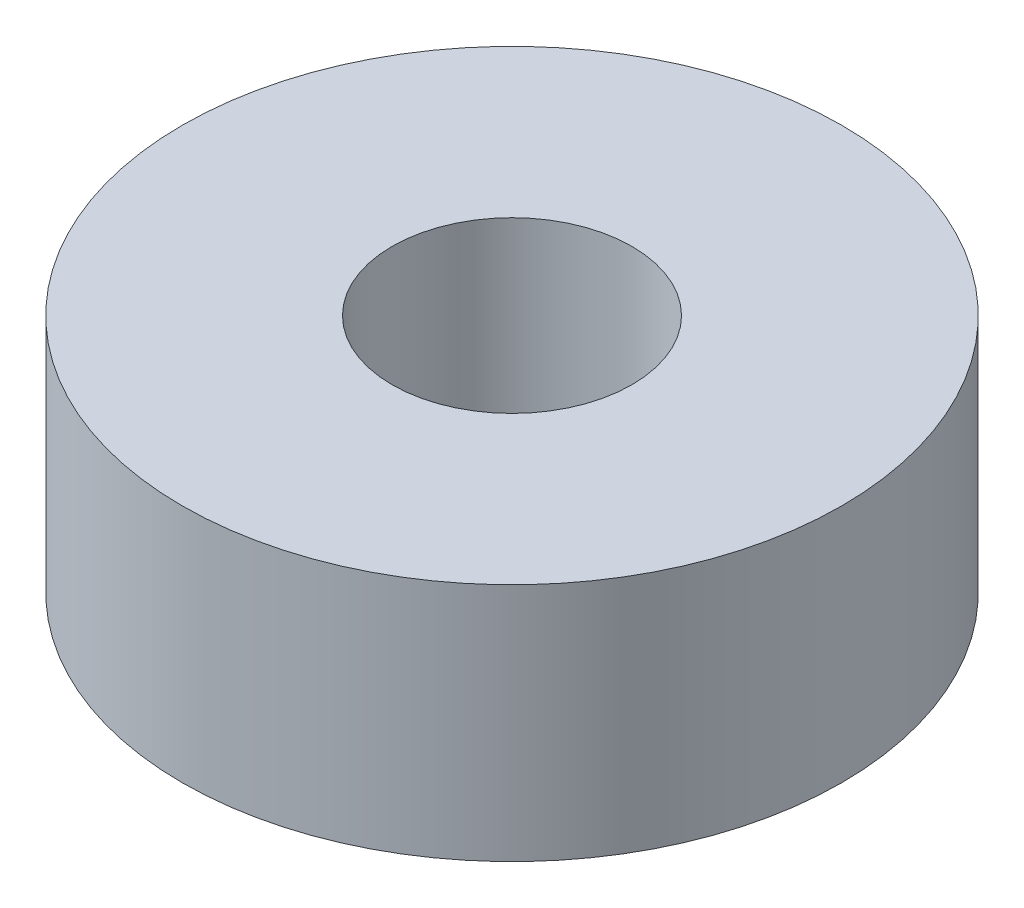
from build123d import *

# Parameters (mm, degrees)
SKETCH_1_R      = 11
SKETCH_1_R_2    = 4
EXTRUDE_1_DEPTH = 8


with BuildPart() as part:
    # 草圖1 → 填料-伸長1 (new body)
    with BuildSketch(Plane(origin=(0, 0, 0), x_dir=(1, 0, 0), z_dir=(0, 1, 0))):
        with Locations(Location((0, 0, 0), (0, 0, 270))):
            Circle(SKETCH_1_R)
        with Locations(Location((0, 0, 0), (0, 0, 270))):
            Circle(SKETCH_1_R_2, mode=Mode.SUBTRACT)
    extrude(amount=EXTRUDE_1_DEPTH)


solid = part.part
